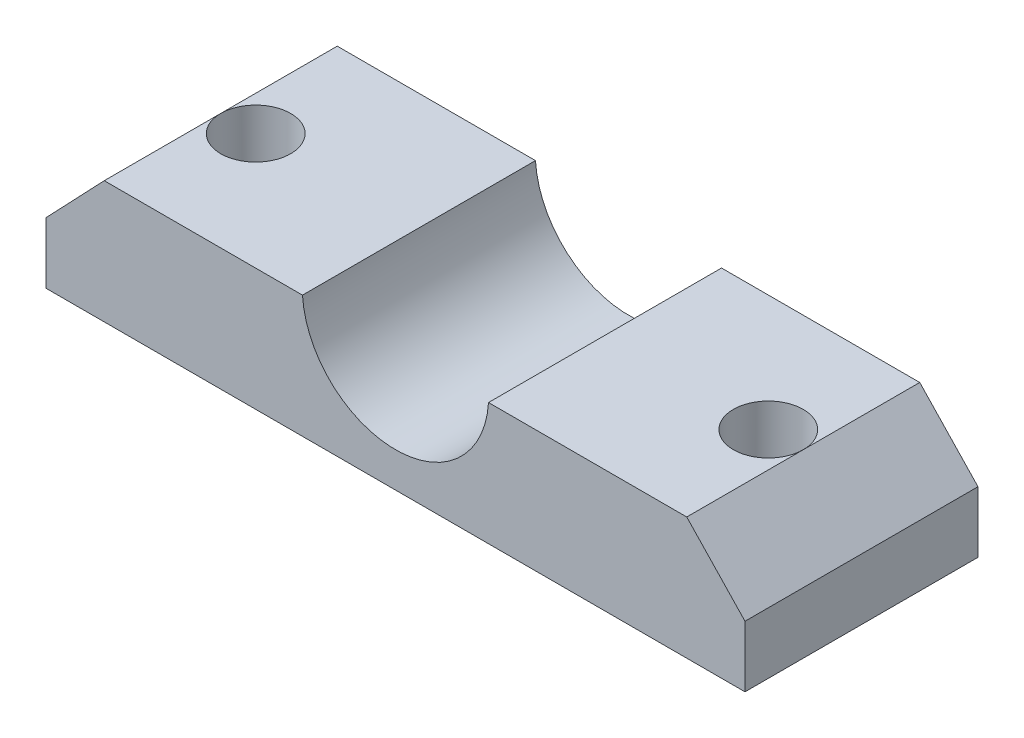
from build123d import *

# Parameters (mm, degrees)
SKETCH1_W           = 30
SKETCH1_H           = 11
SKETCH1_R           = 4
BOSS_EXTRUDE1_DEPTH = 10
SKETCH2_R           = 1.5
CUT_EXTRUDE1_DEPTH  = 17
CUT_EXTRUDE2_START  = -17
CUT_EXTRUDE2_DEPTH  = 17
CUT_EXTRUDE3_DEPTH  = 17


with BuildPart() as part:
    # Sketch1 → Boss-Extrude1 (new body)
    with BuildSketch(Plane.XY):
        Rectangle(SKETCH1_W, SKETCH1_H)
        Circle(SKETCH1_R, mode=Mode.SUBTRACT)
    extrude(amount=BOSS_EXTRUDE1_DEPTH)

    # Sketch2 → Cut-Extrude1 (cut)
    with BuildSketch(Plane(origin=(0, 5.5, 0), x_dir=(1, 0, 0), z_dir=(0, 1, 0))):
        with Locations(Location((-11, -5, 0), (0, 0, 270))):
            Circle(SKETCH2_R)
        with Locations(Location((11, -5, 0), (0, 0, 270))):
            Circle(SKETCH2_R)
    extrude(amount=-CUT_EXTRUDE1_DEPTH, mode=Mode.SUBTRACT)

    # Sketch3 → Cut-Extrude2 (cut)
    with BuildSketch(Plane.XY.offset(10).offset(CUT_EXTRUDE2_START)):
        with BuildLine():
            Line((3.992179856, -0.25), (15, -0.25))
            Line((15, -0.25), (15, 5.5))
            Line((15, 5.5), (-15, 5.5))
            Line((-15, 5.5), (-15, -0.25))
            Line((-15, -0.25), (-3.992179856, -0.25))
            ThreePointArc((-3.992179856, -0.25), (0, 4), (3.992179856, -0.25))
        make_face()
    extrude(amount=CUT_EXTRUDE2_DEPTH, mode=Mode.SUBTRACT)

    # Sketch4 → Cut-Extrude3 (cut)
    with BuildSketch(Plane.XY.offset(10)):
        Polygon((-15, -2.875), (-12.5, -0.25), (-15, -0.25), align=None)
        Polygon((15, -0.25), (12.5, -0.25), (15, -2.875), align=None)
    extrude(amount=-CUT_EXTRUDE3_DEPTH, mode=Mode.SUBTRACT)


solid = part.part
